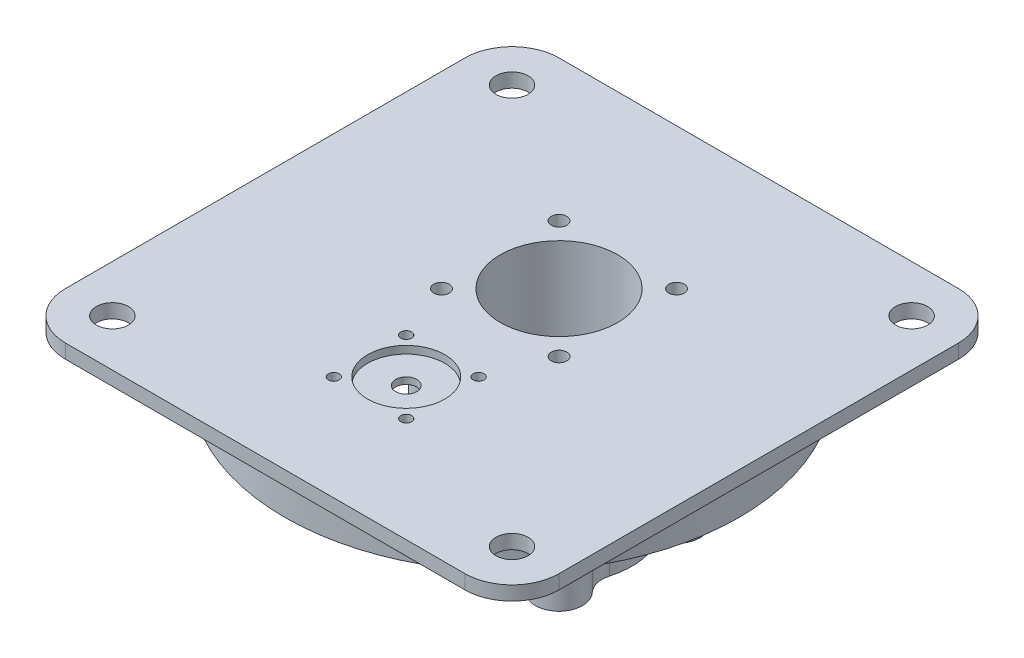
from build123d import *

# Parameters (mm, degrees)
SKETCH1_W           = 105
SKETCH1_H           = 105
BOSS_EXTRUDE1_DEPTH = 3
SKETCH3_R           = 1.15
SKETCH3_R_2         = 2.25
CUT_EXTRUDE1_DEPTH  = 75.306796459
SKETCH4_R           = 8.2
CUT_EXTRUDE2_DEPTH  = 1.6
SKETCH5_R           = 48.3
SKETCH5_R_2         = 45.3
BOSS_EXTRUDE3_DEPTH = 10
SKETCH6_R           = 12.5
CUT_EXTRUDE3_DEPTH  = 75.916620319
BOSS_EXTRUDE4_START = 40.4
SKETCH7_R           = 12.5
BOSS_EXTRUDE4_DEPTH = 40.4
FILLET1_R           = 5
SKETCH8_R           = 2.15
CUT_EXTRUDE4_DEPTH  = 10
SKETCH9_R           = 1.65
CUT_EXTRUDE5_DEPTH  = 82.412898241
FILLET2_R           = 10
SKETCH10_R          = 3.419507724
CUT_EXTRUDE6_DEPTH  = 85.526090694


with BuildPart() as part:
    # Sketch1 → Boss-Extrude1 (new body)
    with BuildSketch(Plane(origin=(0, 0, 0), x_dir=(1, 0, 0), z_dir=(0, 1, 0))):
        Rectangle(SKETCH1_W, SKETCH1_H)
    extrude(amount=BOSS_EXTRUDE1_DEPTH)

    # Sketch3 → Cut-Extrude1 (cut, through all)
    with BuildSketch(Plane(origin=(0, 3, 0), x_dir=(1, 0, 0), z_dir=(0, 1, 0))):
        with Locations(Location((-7.7, -30.2, 0), (0, 0, 270))):
            Circle(SKETCH3_R)
        with Locations(Location((7.7, -30.2, 0), (0, 0, 270))):
            Circle(SKETCH3_R)
        with Locations(Location((7.7, -14.8, 0), (0, 0, 270))):
            Circle(SKETCH3_R)
        with Locations(Location((-7.7, -14.8, 0), (0, 0, 270))):
            Circle(SKETCH3_R)
        with Locations(Location((0, -22.5, 0), (0, 0, 270))):
            Circle(SKETCH3_R_2)
    extrude(amount=-CUT_EXTRUDE1_DEPTH, mode=Mode.SUBTRACT)

    # Sketch4 → Cut-Extrude2 (cut)
    with BuildSketch(Plane(origin=(0, 3, 0), x_dir=(1, 0, 0), z_dir=(0, 1, 0))):
        with Locations(Location((0, -22.5, 0), (0, 0, 270))):
            Circle(SKETCH4_R)
    extrude(amount=-CUT_EXTRUDE2_DEPTH, mode=Mode.SUBTRACT)

    # Sketch5 → Boss-Extrude3 (add)
    with BuildSketch(Plane.XZ):
        with Locations(Location((0, 0, 0), (0, 0, 270))):
            Circle(SKETCH5_R)
        with Locations(Location((0, 0, 0), (0, 0, 270))):
            Circle(SKETCH5_R_2, mode=Mode.SUBTRACT)
    extrude(amount=BOSS_EXTRUDE3_DEPTH)

    # Sketch6 → Cut-Extrude3 (cut, through all)
    with BuildSketch(Plane.XZ):
        with Locations(Location((0, -10, 0), (0, 0, 270))):
            Circle(SKETCH6_R)
    extrude(amount=-CUT_EXTRUDE3_DEPTH, mode=Mode.SUBTRACT)

    # Sketch7 → Boss-Extrude4 (add)
    with BuildSketch(Plane.XZ.offset(BOSS_EXTRUDE4_START)):
        with BuildLine():
            ThreePointArc((-7.60254763, 3.50745237), (-16.035533906, 6.035533906), (-13.50745237, -2.39745237))
            ThreePointArc((-13.50745237, -2.39745237), (-15.5, -10), (-13.50745237, -17.60254763))
            ThreePointArc((-13.50745237, -17.60254763), (-16.035533906, -26.035533906), (-7.60254763, -23.50745237))
            ThreePointArc((-7.60254763, -23.50745237), (0, -25.5), (7.60254763, -23.50745237))
            ThreePointArc((7.60254763, -23.50745237), (16.035533906, -26.035533906), (13.50745237, -17.60254763))
            ThreePointArc((13.50745237, -17.60254763), (15.5, -10), (13.50745237, -2.39745237))
            ThreePointArc((13.50745237, -2.39745237), (16.035533906, 6.035533906), (7.60254763, 3.50745237))
            ThreePointArc((7.60254763, 3.50745237), (0, 5.5), (-7.60254763, 3.50745237))
        make_face()
        with Locations(Location((0, -10, 0), (0, 0, 270))):
            Circle(SKETCH7_R, mode=Mode.SUBTRACT)
    extrude(amount=-BOSS_EXTRUDE4_DEPTH)

    # Fillet1
    fillet1_edges = [part.edges().sort_by_distance(p)[0] for p in [
        (7.60254763, -20.2, 3.50745237),
        (-7.60254763, -20.2, 3.50745237),
        (-13.50745237, -20.2, -2.39745237),
        (-13.50745237, -20.2, -17.60254763),
        (-7.60254763, -20.2, -23.50745237),
        (7.60254763, -20.2, -23.50745237),
        (13.50745237, -20.2, -17.60254763),
        (13.50745237, -20.2, -2.39745237),
    ]]
    fillet(fillet1_edges, radius=FILLET1_R)

    # Sketch8 → Cut-Extrude4 (cut)
    with BuildSketch(Plane.XZ.offset(40.4)):
        with Locations(Location((-12.5, -22.5, 0), (0, 0, 270))):
            Circle(SKETCH8_R)
        with Locations(Location((12.5, -22.5, 0), (0, 0, 270))):
            Circle(SKETCH8_R)
        with Locations(Location((-12.5, 2.5, 0), (0, 0, 270))):
            Circle(SKETCH8_R)
        with Locations(Location((12.5, 2.5, 0), (0, 0, 270))):
            Circle(SKETCH8_R)
    extrude(amount=-CUT_EXTRUDE4_DEPTH, mode=Mode.SUBTRACT)

    # Sketch9 → Cut-Extrude5 (cut, through all)
    with BuildSketch(Plane.XZ.offset(30.4)):
        with Locations(Location((12.5, -22.5, 0), (0, 0, 270))):
            Circle(SKETCH9_R)
        with Locations(Location((-12.5, -22.5, 0), (0, 0, 270))):
            Circle(SKETCH9_R)
        with Locations(Location((-12.5, 2.5, 0), (0, 0, 270))):
            Circle(SKETCH9_R)
        with Locations(Location((12.5, 2.5, 0), (0, 0, 270))):
            Circle(SKETCH9_R)
    extrude(amount=-CUT_EXTRUDE5_DEPTH, mode=Mode.SUBTRACT)

    # Fillet2
    fillet2_edges = [part.edges().sort_by_distance(p)[0] for p in [
        (-52.5, 1.5, -52.5),
        (52.5, 1.5, -52.5),
        (52.5, 1.5, 52.5),
        (-52.5, 1.5, 52.5),
    ]]
    fillet(fillet2_edges, radius=FILLET2_R)

    # Sketch10 → Cut-Extrude6 (cut, through all)
    with BuildSketch(Plane.XZ):
        with Locations(Location((-42.5, -42.5, 0), (0, 0, 270))):
            Circle(SKETCH10_R)
        with Locations(Location((42.5, -42.5, 0), (0, 0, 270))):
            Circle(SKETCH10_R)
        with Locations(Location((42.5, 42.5, 0), (0, 0, 270))):
            Circle(SKETCH10_R)
        with Locations(Location((-42.5, 42.5, 0), (0, 0, 270))):
            Circle(SKETCH10_R)
    extrude(amount=-CUT_EXTRUDE6_DEPTH, mode=Mode.SUBTRACT)


solid = part.part
